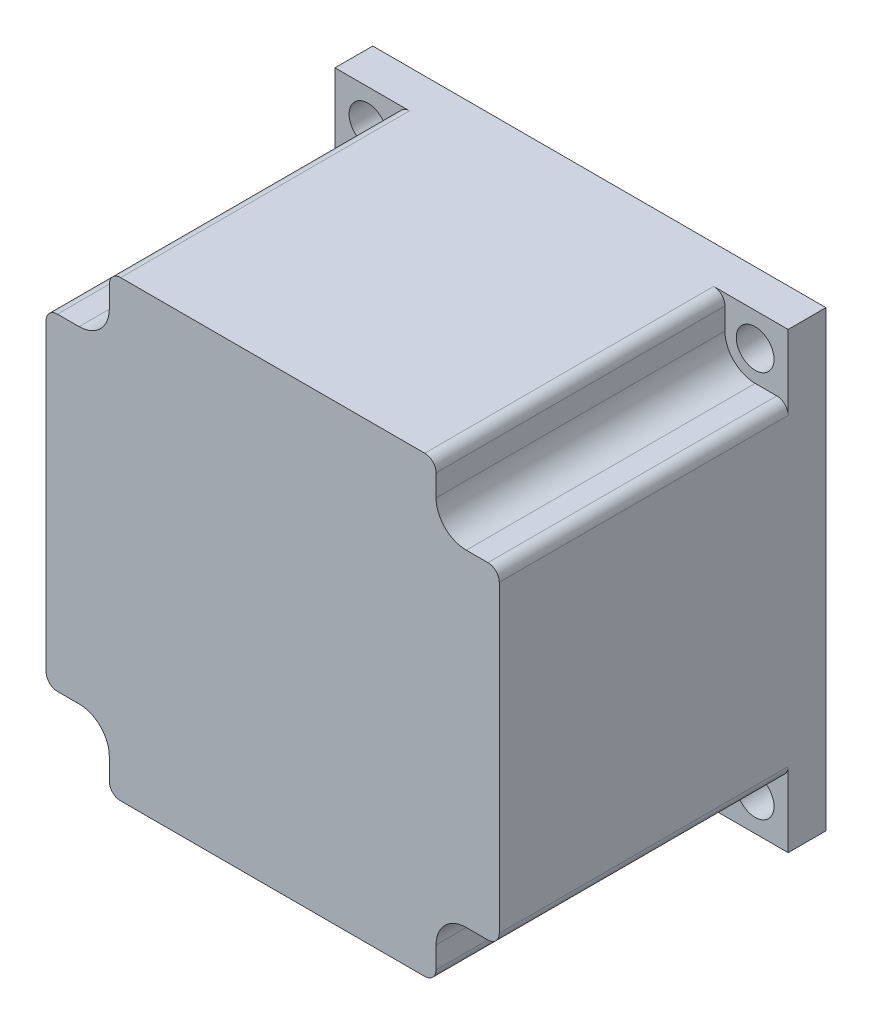
from build123d import *

# Parameters (mm, degrees)
SKETCH_1_W          = 120
SKETCH_1_H          = 120
EXTRUDE_1_DEPTH     = 86.5
SKETCH_2_R          = 55
EXTRUDE_2_DEPTH     = 5
SKETCH_3_R          = 38.5
EXTRUDE_3_DEPTH     = 5.5
SKETCH_4_R          = 9.5
EXTRUDE_4_DEPTH     = 29.5
SKETCH_5_R          = 5
CUT_EXTRUDE_1_DEPTH = 191.479001467
CUT_EXTRUDE_2_DEPTH = 76.5
FILLET_1_R          = 3


with BuildPart() as part:
    # 草图1 → 拉伸1 (new body)
    with BuildSketch(Plane.XY):
        with Locations((60, -60)):
            Rectangle(SKETCH_1_W, SKETCH_1_H)
    extrude(amount=EXTRUDE_1_DEPTH)

    # 草图2 → 拉伸2 (add)
    with BuildSketch(Plane(origin=(0, 0, 0), x_dir=(-1, 0, 0), z_dir=(0, 0, -1))):
        with Locations(Location((-60, -60, 0), (0, 0, 180))):
            Circle(SKETCH_2_R)
    extrude(amount=EXTRUDE_2_DEPTH)

    # 草图3 → 拉伸3 (add)
    with BuildSketch(Plane(origin=(0, 0, -5), x_dir=(-1, 0, 0), z_dir=(0, 0, -1))):
        with Locations((-60, -60)):
            Circle(SKETCH_3_R)
    extrude(amount=EXTRUDE_3_DEPTH)

    # 草图4 → 拉伸4 (add)
    with BuildSketch(Plane(origin=(0, 0, -10.5), x_dir=(-1, 0, 0), z_dir=(0, 0, -1))):
        with Locations((-60, -60)):
            Circle(SKETCH_4_R)
    extrude(amount=EXTRUDE_4_DEPTH)

    # 草图5 → 切除-拉伸1 (cut, through all)
    with BuildSketch(Plane(origin=(0, 0, 0), x_dir=(-1, 0, 0), z_dir=(0, 0, -1))):
        with Locations((-8.734758364, -111.265241636)):
            Circle(SKETCH_5_R)
        with Locations((-8.734758364, -8.734758364)):
            Circle(SKETCH_5_R)
        with Locations((-111.265241636, -111.265241636)):
            Circle(SKETCH_5_R)
        with Locations((-111.265241636, -8.734758364)):
            Circle(SKETCH_5_R)
    extrude(amount=-CUT_EXTRUDE_1_DEPTH, mode=Mode.SUBTRACT)

    # 草图6 → 切除-拉伸2 (cut)
    with BuildSketch(Plane.XY.offset(86.5)):
        with BuildLine():
            Line((8.734758364, -16.734758364), (0, -16.734758364))
            Line((0, -16.734758364), (0, 0))
            Line((0, 0), (16.734758364, 0))
            Line((16.734758364, 0), (16.734758364, -8.734758364))
            ThreePointArc((16.734758364, -8.734758364), (14.391612613, -14.391612613), (8.734758364, -16.734758364))
        make_face()
        with BuildLine():
            Line((111.265241636, -103.265241636), (120, -103.265241636))
            Line((120, -103.265241636), (120, -120))
            Line((120, -120), (103.265241636, -120))
            Line((103.265241636, -120), (103.265241636, -111.265241636))
            ThreePointArc((103.265241636, -111.265241636), (105.608387387, -105.608387387), (111.265241636, -103.265241636))
        make_face()
        with BuildLine():
            Line((120, 0), (103.265241636, 0))
            Line((103.265241636, 0), (103.265241636, -8.734758364))
            ThreePointArc((103.265241636, -8.734758364), (105.608387387, -14.391612613), (111.265241636, -16.734758364))
            Line((111.265241636, -16.734758364), (120, -16.734758364))
            Line((120, -16.734758364), (120, 0))
        make_face()
        with BuildLine():
            Line((0, -120), (16.734758364, -120))
            Line((16.734758364, -120), (16.734758364, -111.265241636))
            ThreePointArc((16.734758364, -111.265241636), (14.391612613, -105.608387387), (8.734758364, -103.265241636))
            Line((8.734758364, -103.265241636), (0, -103.265241636))
            Line((0, -103.265241636), (0, -120))
        make_face()
    extrude(amount=-CUT_EXTRUDE_2_DEPTH, mode=Mode.SUBTRACT)

    # 圆角1
    fillet_1_edges = [part.edges().sort_by_distance(p)[0] for p in [
        (103.265241636, 0, 48.25),
        (120, -16.734758364, 48.25),
        (16.734758364, 0, 48.25),
        (0, -16.734758364, 48.25),
        (120, -103.265241636, 48.25),
        (103.265241636, -120, 48.25),
        (16.734758364, -120, 48.25),
        (0, -103.265241636, 48.25),
    ]]
    fillet(fillet_1_edges, radius=FILLET_1_R)


solid = part.part
